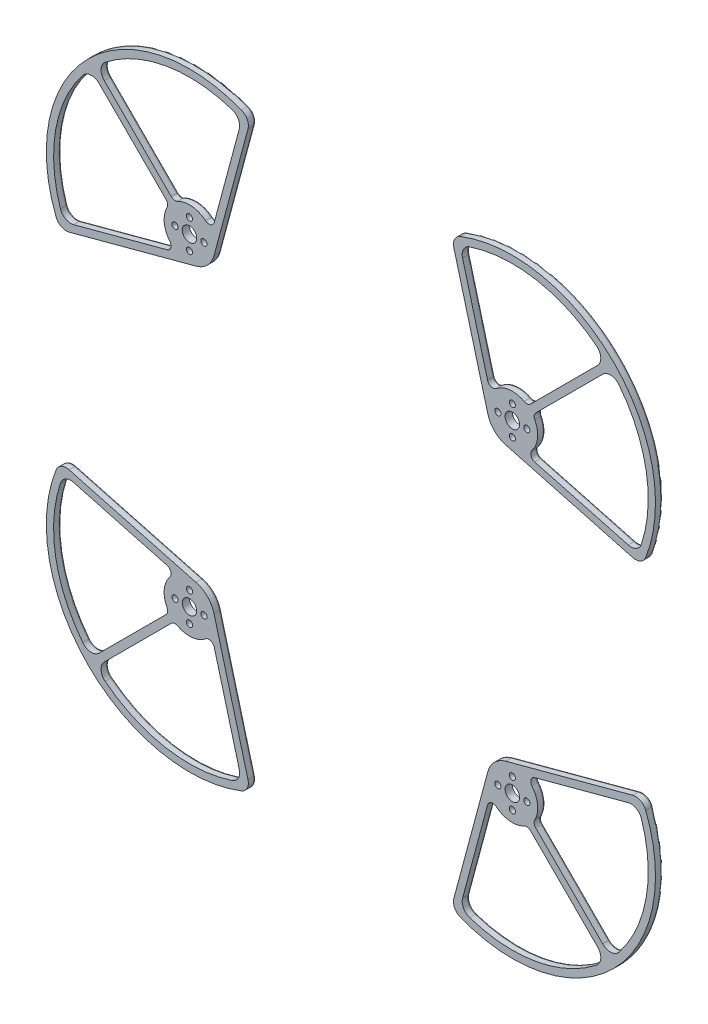
from build123d import *

# Parameters (mm, degrees)
SKETCH_2_R      = 1.7
EXTRUDE_1_DEPTH = 4
FILLET_1_R      = 6
FILLET_2_R      = 3
FILLET_3_R      = 1
FILLET_4_R      = 1


with BuildPart() as part:
    # 草图2 → 凸台-拉伸1 (new body)
    # profile 1 of 8: a face of its own
    with BuildSketch(Plane.XY.offset(-56.57)):
        with BuildLine():
            Line((156.643091194, -56.502253182), (85.471987798, -75.572492861))
            ThreePointArc((85.471987798, -75.572492861), (90.851975234, -75.206083146), (95.971365594, -76.900297782))
            Line((95.971365594, -76.900297782), (158.304862671, -60.198087579))
            ThreePointArc((158.304862671, -60.198087579), (157.498942189, -58.338945161), (156.643091194, -56.502253182))
        make_face()
    # profile 2 of 8: a face of its own
    with BuildSketch(Plane.XY.offset(-56.57)):
        with BuildLine():
            Line((143.523817047, -140.695389922), (100.307626963, -97.479199838))
            ThreePointArc((100.307626963, -97.479199838), (98.994949366, -98.994949366), (97.479199838, -100.307626963))
            Line((97.479199838, -100.307626963), (140.695389922, -143.523817047))
            ThreePointArc((140.695389922, -143.523817047), (142.128463018, -142.128463019), (143.523817047, -140.695389922))
        make_face()
    # profile 3 of 8: a face of its own
    with BuildSketch(Plane.XY.offset(-56.57)):
        with BuildLine():
            ThreePointArc((95.971365594, -76.900297782), (90.851975234, -75.206083146), (85.471987798, -75.572492861))
            ThreePointArc((85.471987798, -75.572492861), (79.195959493, -79.195959493), (75.572492861, -85.471987798))
            ThreePointArc((75.572492861, -85.471987798), (75.206083146, -90.851975234), (76.900297782, -95.971365594))
            ThreePointArc((76.900297782, -95.971365594), (86.208846632, -102.79463307), (97.479199838, -100.307626963))
            Line((97.479199838, -100.307626963), (90.13073061, -92.959157735))
            ThreePointArc((90.13073061, -92.959157735), (85.922041068, -86.660408713), (93.09545443, -89.09545443))
            ThreePointArc((93.09545443, -89.09545443), (93.061233875, -89.617559198), (92.959157735, -90.13073061))
            Line((92.959157735, -90.13073061), (100.307626963, -97.479199838))
            ThreePointArc((100.307626963, -97.479199838), (102.380227959, -93.513009439), (103.09545443, -89.09545443))
            ThreePointArc((103.09545443, -89.09545443), (101.183935647, -82.033682566), (95.971365594, -76.900297782))
        make_face()
        with Locations((81.09545443, -89.09545443)):
            Circle(SKETCH_2_R, mode=Mode.SUBTRACT)
        with Locations((89.09545443, -97.09545443)):
            Circle(SKETCH_2_R, mode=Mode.SUBTRACT)
        with Locations((97.09545443, -89.09545443)):
            Circle(SKETCH_2_R, mode=Mode.SUBTRACT)
        with Locations((89.09545443, -81.09545443)):
            Circle(SKETCH_2_R, mode=Mode.SUBTRACT)
    # profile 4 of 8: a face of its own
    with BuildSketch(Plane.XY.offset(-56.57)):
        with BuildLine():
            ThreePointArc((97.479199838, -100.307626963), (98.994949366, -98.994949366), (100.307626963, -97.479199838))
            Line((100.307626963, -97.479199838), (92.959157735, -90.13073061))
            ThreePointArc((92.959157735, -90.13073061), (91.923881554, -91.923881554), (90.13073061, -92.959157735))
            Line((90.13073061, -92.959157735), (97.479199838, -100.307626963))
        make_face()
    # profile 5 of 8: a face of its own
    with BuildSketch(Plane.XY.offset(-56.57)):
        with BuildLine():
            ThreePointArc((76.900297782, -95.971365594), (75.206083146, -90.851975234), (75.572492861, -85.471987798))
            Line((75.572492861, -85.471987798), (56.502253182, -156.643091194))
            ThreePointArc((56.502253182, -156.643091194), (58.338945161, -157.498942189), (60.198087579, -158.304862671))
            Line((60.198087579, -158.304862671), (76.900297782, -95.971365594))
        make_face()
    # profile 6 of 8: a face of its own
    with BuildSketch(Plane.XY.offset(-56.57)):
        with BuildLine():
            ThreePointArc((60.198087579, -158.304862671), (58.338945161, -157.498942189), (56.502253182, -156.643091194))
            Line((56.502253182, -156.643091194), (55.449416132, -160.572332557))
            ThreePointArc((55.449416132, -160.572332557), (101.686408092, -167.085632567), (143.524772274, -146.353199399))
            Line((143.524772274, -146.353199399), (140.695389922, -143.523817047))
            ThreePointArc((140.695389922, -143.523817047), (102.640618997, -162.862171293), (60.198087579, -158.304862671))
        make_face()
    # profile 7 of 8: a face of its own
    with BuildSketch(Plane.XY.offset(-56.57)):
        with BuildLine():
            Line((160.572332557, -55.449416132), (156.643091194, -56.502253182))
            ThreePointArc((156.643091194, -56.502253182), (157.498942189, -58.338945161), (158.304862671, -60.198087579))
            ThreePointArc((158.304862671, -60.198087579), (162.6335589, -74.359539427), (164.09545443, -89.09545443))
            ThreePointArc((164.09545443, -89.09545443), (158.762976261, -116.870198386), (143.523817047, -140.695389922))
            Line((143.523817047, -140.695389922), (146.353199399, -143.524772274))
            ThreePointArc((146.353199399, -143.524772274), (162.458803087, -118.401069484), (168.09545443, -89.09545443))
            ThreePointArc((168.09545443, -89.09545443), (166.191736351, -71.857028923), (160.572332557, -55.449416132))
        make_face()
    # profile 8 of 8: a face of its own
    with BuildSketch(Plane.XY.offset(-56.57)):
        with BuildLine():
            ThreePointArc((143.524772274, -146.353199399), (144.956890143, -144.956890143), (146.353199399, -143.524772274))
            Line((146.353199399, -143.524772274), (143.523817047, -140.695389922))
            ThreePointArc((143.523817047, -140.695389922), (142.128463018, -142.128463019), (140.695389922, -143.523817047))
            Line((140.695389922, -143.523817047), (143.524772274, -146.353199399))
        make_face()
    extrude(amount=EXTRUDE_1_DEPTH)

    # 圆角1
    fillet_1_edges = [part.edges().sort_by_distance(p)[0] for p in [
        (143.523817047, -140.695389922, -54.57),
        (158.304862671, -60.198087579, -54.57),
        (60.198087579, -158.304862671, -54.57),
        (140.695389922, -143.523817047, -54.57),
        (160.572332557, -55.449416132, -54.57),
        (55.449416132, -160.572332557, -54.57),
    ]]
    fillet(fillet_1_edges, radius=FILLET_1_R)

    # 圆角2
    fillet_2_edges = [part.edges().sort_by_distance(p)[0] for p in [
        (100.307626963, -97.479199838, -54.57),
        (95.971365594, -76.900297782, -54.57),
        (97.479199838, -100.307626963, -54.57),
        (76.900297782, -95.971365594, -54.57),
    ]]
    fillet(fillet_2_edges, radius=FILLET_2_R)

    # 圆角3
    fillet_3_edges = [part.edges().sort_by_distance(p)[0] for p in [
        (66.182496528, -120.515931196, -56.57),
        (79.195959493, -79.195959493, -56.57),
        (120.515931196, -66.182496528, -56.57),
        (144.956890143, -144.956890143, -56.57),
        (57.235101116, -159.823117824, -56.57),
        (159.823117824, -57.235101116, -56.57),
    ]]
    fillet(fillet_3_edges, radius=FILLET_3_R)

    # 圆角4
    fillet_4_edges = [part.edges().sort_by_distance(p)[0] for p in [
        (127.257691439, -68.517152037, -56.57),
        (103.025984962, -87.702501067, -56.57),
        (87.702501067, -103.025984962, -56.57),
        (68.517152037, -127.257691439, -56.57),
        (117.656465907, -120.484893031, -56.57),
        (120.484893031, -117.656465907, -56.57),
        (99.39206661, -77.40518023, -56.57),
        (77.40518023, -99.39206661, -56.57),
        (97.495183118, -101.153472176, -56.57),
        (101.153472176, -97.495183118, -56.57),
        (162.953911951, -102.13110756, -56.57),
        (102.13110756, -162.953911951, -56.57),
        (143.562047475, -137.889800397, -56.57),
        (137.889800397, -143.562047475, -56.57),
        (157.445036572, -62.12230984, -56.57),
        (62.12230984, -157.445036572, -56.57),
    ]]
    fillet(fillet_4_edges, radius=FILLET_4_R)


with BuildPart() as body_2:
    # 镜向1: mirrored copy
    add(part.part.mirror(Plane.ZX))


with BuildPart() as body_3:
    # 镜向2: mirrored copy
    add(part.part.mirror(Plane(origin=(0, 0, 0), x_dir=(0, 0, 1), z_dir=(1, 0, 0))))


with BuildPart() as body_4:
    # Mirror 2 2: mirrored copy
    add(body_2.part.mirror(Plane(origin=(0, 0, 0), x_dir=(0, 0, 1), z_dir=(1, 0, 0))))


solid = Compound([part.part, body_2.part, body_3.part, body_4.part])
